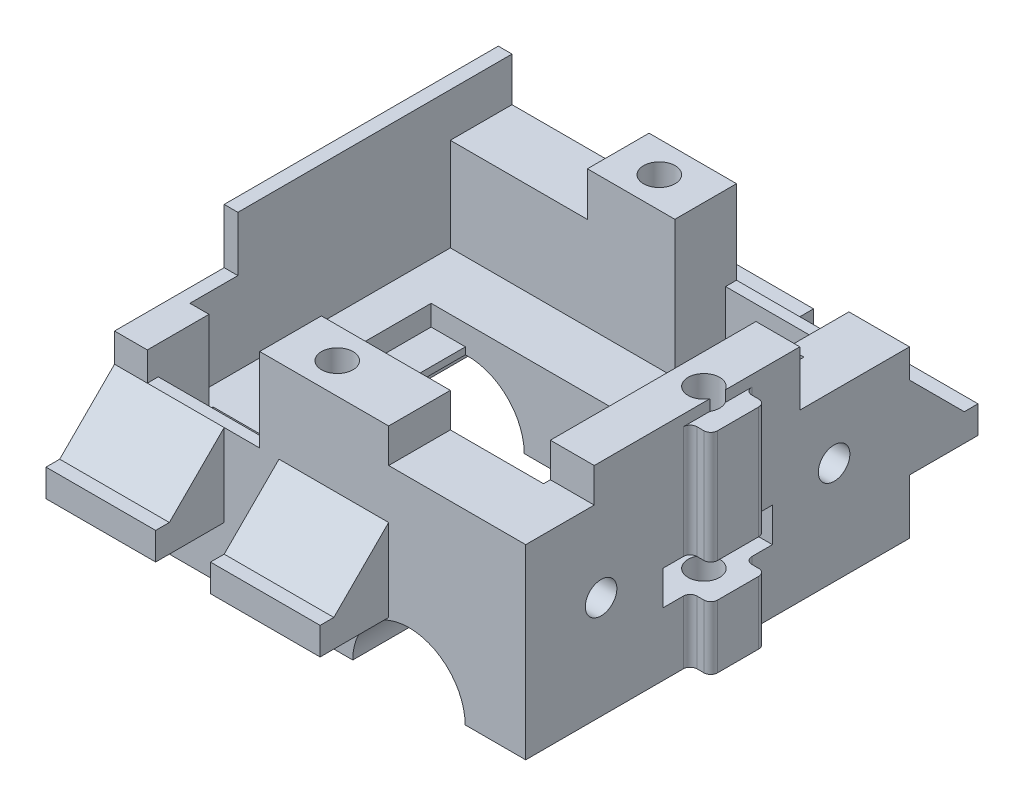
from build123d import *

# Parameters (mm, degrees)
SKETCH1_W           = 28
SKETCH1_H           = 16.1
BOSS_EXTRUDE1_DEPTH = 30
SKETCH2_W           = 10
SKETCH2_H           = 2.5
CUT_EXTRUDE1_DEPTH  = 5
SKETCH3_W           = 10
SKETCH3_H           = 4
CUT_EXTRUDE2_DEPTH  = 8
SKETCH4_W           = 10
SKETCH4_H           = 3.2
CUT_EXTRUDE3_DEPTH  = 8
SKETCH5_W           = 11
SKETCH5_H           = 4
CUT_EXTRUDE4_DEPTH  = 8
SKETCH6_W           = 20
SKETCH6_H           = 2
BOSS_EXTRUDE2_DEPTH = 5
CHAMFER1_SIZE       = 4
SKETCH7_W           = 20
SKETCH7_H           = 2
BOSS_EXTRUDE3_DEPTH = 5
CHAMFER2_SIZE       = 4
SKETCH9_W           = 25.8
SKETCH9_H           = 19
CUT_EXTRUDE6_DEPTH  = 10
SKETCH13_R          = 4.1
CUT_EXTRUDE10_DEPTH = 27.2
SKETCH14_R          = 4.1
CUT_EXTRUDE11_DEPTH = 27.2
SKETCH15_W          = 8.2
SKETCH15_H          = 4
CUT_EXTRUDE12_DEPTH = 27.2
SKETCH16_W          = 0.59230819
SKETCH16_H          = 0.8
SKETCH16_W_2        = 1.617695922
CUT_EXTRUDE13_DEPTH = 4
SKETCH17_W          = 1.5
SKETCH17_H          = 4
BOSS_EXTRUDE4_DEPTH = 16.1
FILLET1_R           = 0.5
SKETCH18_R          = 3.5
CUT_EXTRUDE14_DEPTH = 6.1
SKETCH19_W          = 8
SKETCH19_H          = 1
CUT_EXTRUDE15_DEPTH = 10
SKETCH20_W          = 20.5
SKETCH20_H          = 10.6
CUT_EXTRUDE16_DEPTH = 1.5
SKETCH21_W          = 5.7
SKETCH21_H          = 8
CUT_EXTRUDE17_DEPTH = 1.5
SKETCH22_W          = 8
SKETCH22_H          = 2.5
CUT_EXTRUDE18_DEPTH = 1.5
SKETCH23_R          = 1.15
CUT_EXTRUDE19_DEPTH = 75.620049118
SKETCH24_W          = 8.2
SKETCH24_H          = 0.8
CUT_EXTRUDE20_DEPTH = 2.1
CUT_EXTRUDE21_REACH = 75.421
SKETCH25_W          = 7.929527271
SKETCH25_H          = 0.8
CUT_EXTRUDE22_START = -5
SKETCH26_W          = 4
SKETCH26_H          = 6
CUT_EXTRUDE22_DEPTH = 5
CUT_EXTRUDE23_START = -5
SKETCH27_W          = 4
SKETCH27_H          = 6
CUT_EXTRUDE23_DEPTH = 5
SKETCH28_R          = 1.15
CUT_EXTRUDE24_DEPTH = 3.2
CUT_EXTRUDE25_REACH = 75.764
SKETCH29_W          = 15.5
SKETCH29_H          = 10.6


with BuildPart() as part:
    # Sketch1 → Boss-Extrude1 (new body)
    with BuildSketch(Plane(origin=(0, 0, 0), x_dir=(0, 0, -1), z_dir=(1, 0, 0))):
        with Locations((-46.701535197, -0.990821865)):
            Rectangle(SKETCH1_W, SKETCH1_H)
    extrude(amount=BOSS_EXTRUDE1_DEPTH)

    # Sketch2 → Cut-Extrude1 (cut)
    with BuildSketch(Plane.XY.offset(60.701535197)):
        with Locations((25, 5.809178135)):
            Rectangle(SKETCH2_W, SKETCH2_H)
    extrude(amount=-CUT_EXTRUDE1_DEPTH, mode=Mode.SUBTRACT)

    # Sketch3 → Cut-Extrude2 (cut)
    with BuildSketch(Plane.XY.offset(60.701535197)):
        with Locations((5, 5.059178135)):
            Rectangle(SKETCH3_W, SKETCH3_H)
    extrude(amount=-CUT_EXTRUDE2_DEPTH, mode=Mode.SUBTRACT)

    # Sketch4 → Cut-Extrude3 (cut)
    with BuildSketch(Plane(origin=(0, 0, 32.701535197), x_dir=(-1, 0, 0), z_dir=(0, 0, -1))):
        with Locations((-6, 5.459178135)):
            Rectangle(SKETCH4_W, SKETCH4_H)
    extrude(amount=-CUT_EXTRUDE3_DEPTH, mode=Mode.SUBTRACT)

    # Sketch5 → Cut-Extrude4 (cut)
    with BuildSketch(Plane(origin=(0, 0, 32.701535197), x_dir=(-1, 0, 0), z_dir=(0, 0, -1))):
        with Locations((-24.5, 5.059178135)):
            Rectangle(SKETCH5_W, SKETCH5_H)
    extrude(amount=-CUT_EXTRUDE4_DEPTH, mode=Mode.SUBTRACT)

    # Sketch6 → Boss-Extrude2 (add)
    with BuildSketch(Plane(origin=(0, 0, 32.701535197), x_dir=(-1, 0, 0), z_dir=(0, 0, -1))):
        with Locations((-20, -4.040821865)):
            Rectangle(SKETCH6_W, SKETCH6_H)
    extrude(amount=BOSS_EXTRUDE2_DEPTH)

    # Chamfer1
    chamfer1_edges = [part.edges().sort_by_distance(p)[0] for p in [
        (20, -3.040821865, 32.701535197),
    ]]
    chamfer(chamfer1_edges, length=CHAMFER1_SIZE)

    # Sketch7 → Boss-Extrude3 (add)
    with BuildSketch(Plane.XY.offset(60.701535197)):
        with Locations((10, -4.040821865)):
            Rectangle(SKETCH7_W, SKETCH7_H)
    extrude(amount=BOSS_EXTRUDE3_DEPTH)

    # Chamfer2
    chamfer2_edges = [part.edges().sort_by_distance(p)[0] for p in [
        (10, -3.040821865, 60.701535197),
    ]]
    chamfer(chamfer2_edges, length=CHAMFER2_SIZE)

    # Sketch9 → Cut-Extrude6 (cut)
    with BuildSketch(Plane(origin=(0, 7.059178135, 0), x_dir=(1, 0, 0), z_dir=(0, 1, 0))):
        with Locations((13.9, -46.701535197)):
            Rectangle(SKETCH9_W, SKETCH9_H)
    extrude(amount=-CUT_EXTRUDE6_DEPTH, mode=Mode.SUBTRACT)

    # Sketch13 → Cut-Extrude10 (cut)
    with BuildSketch(Plane.XY.offset(60.701535197)):
        with Locations((21.482304078, -9.040821865)):
            Circle(SKETCH13_R)
    extrude(amount=-CUT_EXTRUDE10_DEPTH, mode=Mode.SUBTRACT)

    # Sketch14 → Cut-Extrude11 (cut)
    with BuildSketch(Plane(origin=(0, 0, 32.701535197), x_dir=(-1, 0, 0), z_dir=(0, 0, -1))):
        with Locations((-6.49230819, -9.040821865)):
            Circle(SKETCH14_R)
    extrude(amount=-CUT_EXTRUDE11_DEPTH, mode=Mode.SUBTRACT)

    # Sketch15 → Cut-Extrude12 (cut)
    with BuildSketch(Plane.XZ.offset(9.040821865)):
        with Locations((6.49230819, 57.901535197)):
            Rectangle(SKETCH15_W, SKETCH15_H)
        with Locations((21.482304078, 35.501535197)):
            Rectangle(SKETCH15_W, SKETCH15_H)
    extrude(amount=-CUT_EXTRUDE12_DEPTH, mode=Mode.SUBTRACT)

    # Sketch16 → Cut-Extrude13 (cut)
    with BuildSketch(Plane(origin=(0, 7.059178135, 0), x_dir=(1, 0, 0), z_dir=(0, 1, 0))):
        with Locations((10.296154095, -60.301535197)):
            Rectangle(SKETCH16_W, SKETCH16_H)
        with Locations((18.191152039, -33.101535197)):
            Rectangle(SKETCH16_W_2, SKETCH16_H)
    extrude(amount=-CUT_EXTRUDE13_DEPTH, mode=Mode.SUBTRACT)

    # Sketch17 → Boss-Extrude4 (add)
    with BuildSketch(Plane.XZ.offset(9.040821865)):
        with Locations((30.75, 46.701535197)):
            Rectangle(SKETCH17_W, SKETCH17_H)
    extrude(amount=-BOSS_EXTRUDE4_DEPTH)

    # Fillet1
    fillet1_edges = [part.edges().sort_by_distance(p)[0] for p in [
        (30, -0.990821865, 44.701535197),
        (30, -0.990821865, 48.701535197),
        (31.5, -0.990821865, 48.701535197),
        (31.5, -0.990821865, 44.701535197),
    ]]
    fillet(fillet1_edges, radius=FILLET1_R)

    # Sketch18 → Cut-Extrude14 (cut)
    with BuildSketch(Plane.XZ.offset(9.040821865)):
        with Locations(Location((13.985, 46.701535197, 0), (0, 0, 194.224464848))):
            Circle(SKETCH18_R)
    extrude(amount=-CUT_EXTRUDE14_DEPTH, mode=Mode.SUBTRACT)

    # Sketch19 → Cut-Extrude15 (cut)
    with BuildSketch(Plane(origin=(31.5, 0, 0), x_dir=(0, 0, -1), z_dir=(1, 0, 0))):
        with Locations((-46.701535197, -2.440821865)):
            Rectangle(SKETCH19_W, SKETCH19_H)
    extrude(amount=-CUT_EXTRUDE15_DEPTH, mode=Mode.SUBTRACT)

    # Sketch20 → Cut-Extrude16 (cut)
    with BuildSketch(Plane(origin=(0, -2.940821865, 0), x_dir=(1, 0, 0), z_dir=(0, 1, 0))):
        with Locations((14.05, -46.701535197)):
            Rectangle(SKETCH20_W, SKETCH20_H)
    extrude(amount=-CUT_EXTRUDE16_DEPTH, mode=Mode.SUBTRACT)

    # Sketch21 → Cut-Extrude17 (cut)
    with BuildSketch(Plane(origin=(0, -2.940821865, 0), x_dir=(1, 0, 0), z_dir=(0, 1, 0))):
        with Locations((27.15, -46.701535197)):
            Rectangle(SKETCH21_W, SKETCH21_H)
    extrude(amount=-CUT_EXTRUDE17_DEPTH, mode=Mode.SUBTRACT)

    # Sketch22 → Cut-Extrude18 (cut)
    with BuildSketch(Plane(origin=(31.5, 0, 0), x_dir=(0, 0, -1), z_dir=(1, 0, 0))):
        with Locations((-46.701535197, -3.190821865)):
            Rectangle(SKETCH22_W, SKETCH22_H)
    extrude(amount=-CUT_EXTRUDE18_DEPTH, mode=Mode.SUBTRACT)

    # Sketch23 → Cut-Extrude19 (cut, through all)
    with BuildSketch(Plane(origin=(0, 7.059178135, 0), x_dir=(1, 0, 0), z_dir=(0, 1, 0))):
        with Locations(Location((29, -46.701535197, 0), (0, 0, 270))):
            Circle(SKETCH23_R)
        with Locations(Location((14, -34.951535197, 0), (0, 0, 270))):
            Circle(SKETCH23_R)
        with Locations(Location((14, -58.451535197, 0), (0, 0, 270))):
            Circle(SKETCH23_R)
    extrude(amount=-CUT_EXTRUDE19_DEPTH, mode=Mode.SUBTRACT)

    # Sketch24 → Cut-Extrude20 (cut)
    with BuildSketch(Plane(origin=(0, 3.059178135, 0), x_dir=(1, 0, 0), z_dir=(0, 1, 0))):
        with Locations((21.482304078, -33.101535197)):
            Rectangle(SKETCH24_W, SKETCH24_H)
        with Locations((6.49230819, -60.301535197)):
            Rectangle(SKETCH24_W, SKETCH24_H)
    extrude(amount=-CUT_EXTRUDE20_DEPTH, mode=Mode.SUBTRACT)

    # Cut-Extrude21: up to this face of the body (flat: up to its plane)
    cut_extrude21_end = Plane(part.part.faces().sort_by_distance((30, -1.445232759, 54.822020691))[0])
    # Sketch25 → Cut-Extrude21 (cut, up to the picked face)
    with BuildSketch(Plane(origin=(31.5, 0, 0), x_dir=(0, 0, -1), z_dir=(1, 0, 0)), mode=Mode.PRIVATE) as cut_extrude21_sk1:
        with Locations((-46.553400254, 6.659178135)):
            Rectangle(SKETCH25_W, SKETCH25_H)
    cut_extrude21_tool1 = split(extrude(cut_extrude21_sk1.sketch, amount=-CUT_EXTRUDE21_REACH, mode=Mode.PRIVATE), bisect_by=cut_extrude21_end, keep=Keep.BOTH, mode=Mode.PRIVATE)
    add(cut_extrude21_tool1.solids().sort_by(Axis((31.5, 6.659178, 46.5534), (-1, 0, 0)))[0], mode=Mode.SUBTRACT)

    # Sketch26 → Cut-Extrude22 (cut)
    with BuildSketch(Plane.XY.offset(65.701535197).offset(CUT_EXTRUDE22_START)):
        with Locations((10, -2.040821865)):
            Rectangle(SKETCH26_W, SKETCH26_H)
    extrude(amount=CUT_EXTRUDE22_DEPTH, mode=Mode.SUBTRACT)

    # Sketch27 → Cut-Extrude23 (cut)
    with BuildSketch(Plane(origin=(0, 0, 27.701535197), x_dir=(-1, 0, 0), z_dir=(0, 0, -1)).offset(CUT_EXTRUDE23_START)):
        with Locations((-20, -2.040821865)):
            Rectangle(SKETCH27_W, SKETCH27_H)
    extrude(amount=CUT_EXTRUDE23_DEPTH, mode=Mode.SUBTRACT)

    # Sketch28 → Cut-Extrude24 (cut)
    with BuildSketch(Plane(origin=(30, 0, 0), x_dir=(0, 0, -1), z_dir=(1, 0, 0))):
        with Locations((-55.201535197, -1.540821865)):
            Circle(SKETCH28_R)
        with Locations((-38.201535197, -1.540821865)):
            Circle(SKETCH28_R)
    extrude(amount=-CUT_EXTRUDE24_DEPTH, mode=Mode.SUBTRACT)

    # Cut-Extrude25: up to this face of the body (flat: up to its plane)
    cut_extrude25_end = Plane(part.part.faces().sort_by_distance((10.921875254, -9.040821865, 51.731547487))[0])
    # Sketch29 → Cut-Extrude25 (cut, up to the picked face)
    with BuildSketch(Plane(origin=(0, -4.440821865, 0), x_dir=(1, 0, 0), z_dir=(0, 1, 0)), mode=Mode.PRIVATE) as cut_extrude25_sk1:
        with Locations((14.05, -46.701535197)):
            Rectangle(SKETCH29_W, SKETCH29_H)
    cut_extrude25_tool1 = split(extrude(cut_extrude25_sk1.sketch, amount=-CUT_EXTRUDE25_REACH, mode=Mode.PRIVATE), bisect_by=cut_extrude25_end, keep=Keep.BOTH, mode=Mode.PRIVATE)
    add(cut_extrude25_tool1.solids().sort_by(Axis((14.05, -4.440822, 46.701535), (0, -1, 0)))[0], mode=Mode.SUBTRACT)


solid = part.part
